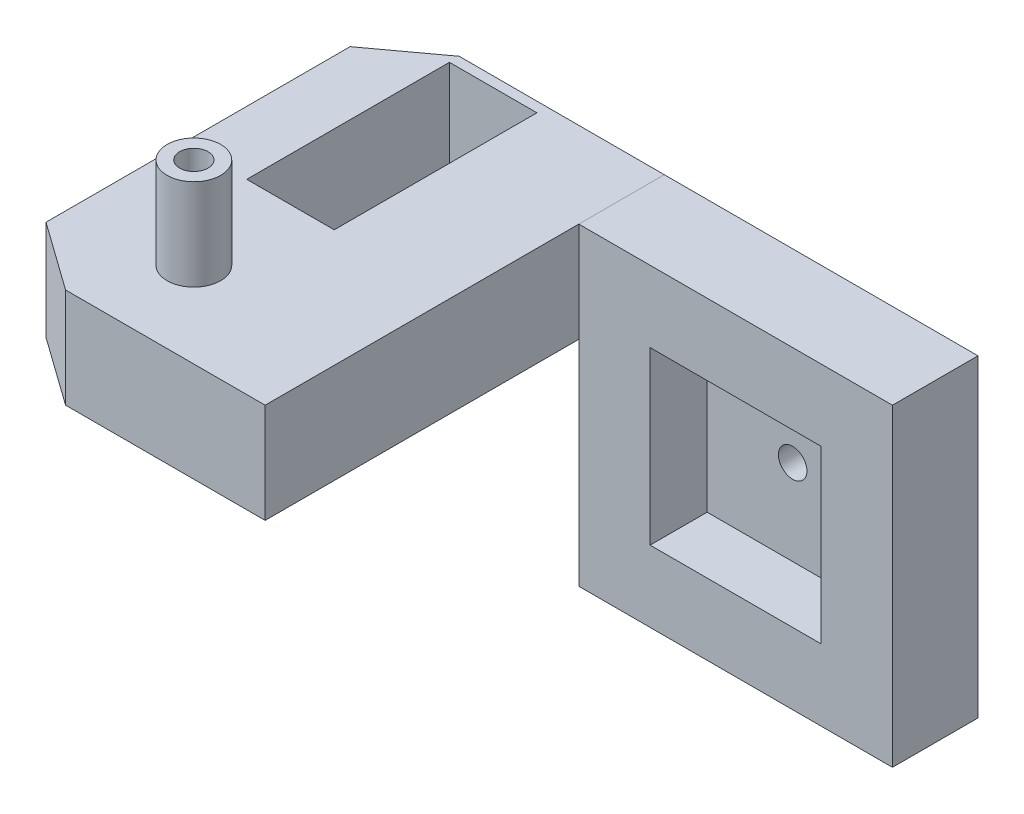
from build123d import *

# Parameters (mm, degrees)
SKETCH1_W           = 55
SKETCH1_H           = 55
SKETCH1_W_2         = 30
SKETCH1_H_2         = 30
BOSS_EXTRUDE1_DEPTH = 15
SKETCH5_W           = 70
SKETCH5_H           = 70
BOSS_EXTRUDE4_DEPTH = 17.5
CUT_EXTRUDE1_DEPTH  = 143.483240955
SKETCH8_W           = 15.334329656
SKETCH8_H           = 35.542805721
CUT_EXTRUDE3_DEPTH  = 126.3514749
SKETCH9_R           = 4.7
BOSS_EXTRUDE5_DEPTH = 16
SKETCH10_R          = 2.5
CUT_EXTRUDE4_DEPTH  = 10
SKETCH12_W          = 30
SKETCH12_H          = 30
BOSS_EXTRUDE6_DEPTH = 5
SKETCH13_R          = 2.5
CUT_EXTRUDE5_DEPTH  = 117.050297595


with BuildPart() as part:
    # Sketch1 → Boss-Extrude1 (new body)
    with BuildSketch(Plane.XY):
        with Locations((-13.749602036, -10.640258422)):
            Rectangle(SKETCH1_W, SKETCH1_H)
        with Locations((-13.749602036, -10.640258422)):
            Rectangle(SKETCH1_W_2, SKETCH1_H_2, mode=Mode.SUBTRACT)
    extrude(amount=BOSS_EXTRUDE1_DEPTH)

    # Sketch12 → Boss-Extrude6 (add)
    with BuildSketch(Plane(origin=(-732.77025481, -892.317517431, 5), x_dir=(1, 0, 0), z_dir=(0, 0, 1))):
        with Locations((719.020652774, 881.677259009)):
            Rectangle(SKETCH12_W, SKETCH12_H)
    extrude(amount=-BOSS_EXTRUDE6_DEPTH)

    # Sketch13 → Cut-Extrude5 (cut, through all)
    with BuildSketch(Plane.XY.offset(5)):
        with Locations((-13.749602036, -10.640258422)):
            Circle(SKETCH13_R)
    extrude(amount=-CUT_EXTRUDE5_DEPTH, mode=Mode.SUBTRACT)


with BuildPart() as body_2:
    # Sketch5 → Boss-Extrude4 (new body)
    with BuildSketch(Plane(origin=(0, 16.859741578, 0), x_dir=(1, 0, 0), z_dir=(0, 1, 0))):
        with Locations((-76.249602036, -35)):
            Rectangle(SKETCH5_W, SKETCH5_H)
    extrude(amount=-BOSS_EXTRUDE4_DEPTH)

    # Sketch6 → Cut-Extrude1 (cut, through all)
    with BuildSketch(Plane(origin=(0, 16.859741578, 0), x_dir=(1, 0, 0), z_dir=(0, 1, 0))):
        Polygon((-77.220552794, 0), (-111.249602036, 0), (-111.249602036, -70), (-76.249602036, -70), (-88.249602036, -61.428571429), (-88.249602036, -8.102672193), align=None)
    extrude(amount=-CUT_EXTRUDE1_DEPTH, mode=Mode.SUBTRACT)

    # Sketch8 → Cut-Extrude3 (cut, through all)
    with BuildSketch(Plane(origin=(0, 16.859741578, 0), x_dir=(1, 0, 0), z_dir=(0, 1, 0))):
        with Locations((-69.49219179, -19.543404801)):
            Rectangle(SKETCH8_W, SKETCH8_H)
    extrude(amount=-CUT_EXTRUDE3_DEPTH, mode=Mode.SUBTRACT)

    # Sketch9 → Boss-Extrude5 (add)
    with BuildSketch(Plane(origin=(0, 16.859741578, 0), x_dir=(1, 0, 0), z_dir=(0, 1, 0))):
        with Locations(Location((-68.749602036, -55, 0), (0, 0, 270))):
            Circle(SKETCH9_R)
    extrude(amount=BOSS_EXTRUDE5_DEPTH)

    # Sketch10 → Cut-Extrude4 (cut)
    with BuildSketch(Plane(origin=(0, 32.859741578, 0), x_dir=(1, 0, 0), z_dir=(0, 1, 0))):
        with Locations(Location((-68.749602036, -55, 0), (0, 0, 270))):
            Circle(SKETCH10_R)
    extrude(amount=-CUT_EXTRUDE4_DEPTH, mode=Mode.SUBTRACT)


solid = Compound([part.part, body_2.part])
